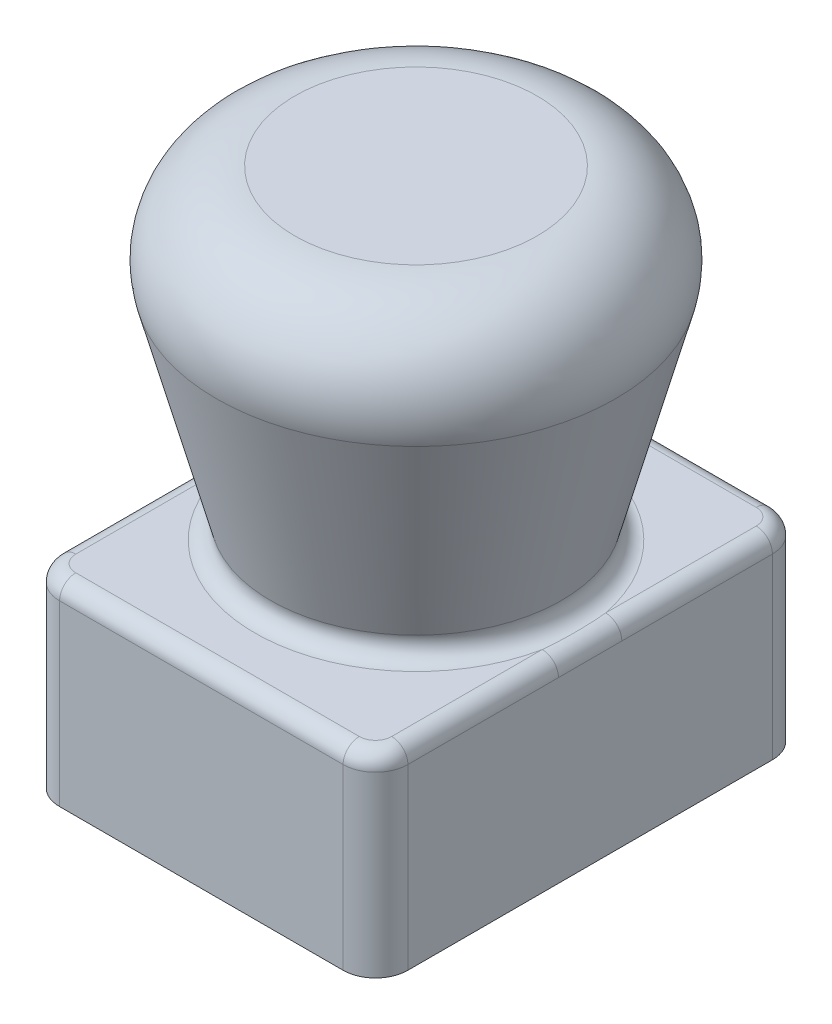
from build123d import *

# Parameters (mm, degrees)
ESQUISSE3_W             = 21.5
ESQUISSE3_H             = 26.5
BOSS_EXTRU_2_DEPTH      = 12
CONG_1_R                = 5
CONG_2_R                = 2
CONG_3_R                = 1
CONG_4_R                = 1
ESQUISSE4_R             = 6.1
ENL_V_MAT_EXTRU_1_DEPTH = 28
CONG_5_R                = 6


with BuildPart() as part:
    # Esquisse2 → Révolution1 (revolve)
    with BuildSketch(Plane.XY, mode=Mode.PRIVATE) as r_volution1_sk:
        Polygon((0, 20), (14, 20), (8.641016151, 0), (0, 0), align=None)
    revolve(r_volution1_sk.sketch.rotate(Axis((0, 0, 0), (0, 1, 0)), 90), axis=Axis((0, 0, 0), (0, 1, 0)))

    # Esquisse3 → Boss.-Extru.2 (add)
    with BuildSketch(Plane.XZ):
        Rectangle(ESQUISSE3_W, ESQUISSE3_H)
    extrude(amount=BOSS_EXTRU_2_DEPTH)

    # Congé1
    cong_1_edges = [part.edges().sort_by_distance(p)[0] for p in [
        (0, 20, 14),
    ]]
    fillet(cong_1_edges, radius=CONG_1_R)

    # Congé2
    cong_2_edges = [part.edges().sort_by_distance(p)[0] for p in [
        (10.75, -6, 13.25),
        (-10.75, -6, 13.25),
        (-10.75, -6, -13.25),
        (10.75, -6, -13.25),
    ]]
    fillet(cong_2_edges, radius=CONG_2_R)

    # Congé3
    cong_3_edges = [part.edges().sort_by_distance(p)[0] for p in [
        (0, 0, 8.641016151),
    ]]
    fillet(cong_3_edges, radius=CONG_3_R)

    # Congé4
    cong_4_edges = [part.edges().sort_by_distance(p)[0] for p in [
        (-10.75, 0, 0),
        (10.75, 0, 0),
        (0, 0, -13.25),
        (0, 0, 13.25),
        (10.164213562, 0, -12.664213562),
        (-10.164213562, 0, -12.664213562),
        (10.164213562, 0, 12.664213562),
        (-10.164213562, 0, 12.664213562),
    ]]
    fillet(cong_4_edges, radius=CONG_4_R)

    # Esquisse4 → Enlèv. mat.-Extru.1 (cut)
    with BuildSketch(Plane.XZ.offset(12)):
        with Locations(Location((0, 0, 0), (0, 0, 270))):
            Circle(ESQUISSE4_R)
    extrude(amount=-ENL_V_MAT_EXTRU_1_DEPTH, mode=Mode.SUBTRACT)

    # Congé5
    cong_5_edges = [part.edges().sort_by_distance(p)[0] for p in [
        (0, 16, 6.1),
    ]]
    fillet(cong_5_edges, radius=CONG_5_R)


solid = part.part
